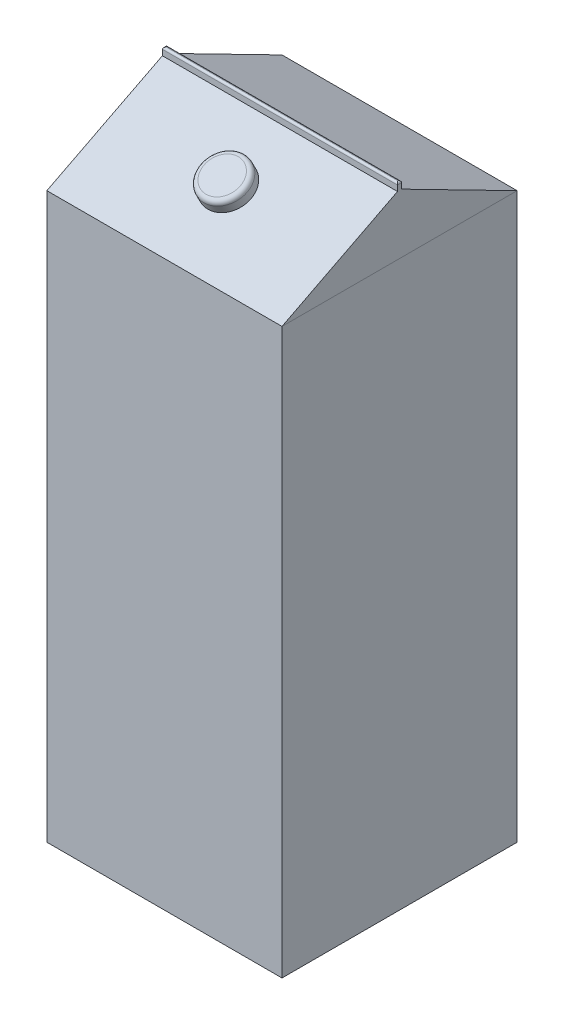
from build123d import *

# Parameters (mm, degrees)
SKETCH3_W           = 63.5
SKETCH3_H           = 152.4
BOSS_EXTRUDE3_DEPTH = 63.5
BOSS_EXTRUDE5_DEPTH = 63.5
FILLET5_R           = 0.508
SKETCH6_R           = 6.164809323
BOSS_EXTRUDE6_DEPTH = 3.556
FILLET6_R           = 1.27


with BuildPart() as part:
    # Sketch3 → Boss-Extrude3 (new body)
    with BuildSketch(Plane(origin=(0, 0, 0), x_dir=(0, 0, -1), z_dir=(1, 0, 0))):
        with Locations((31.75, 76.2)):
            Rectangle(SKETCH3_W, SKETCH3_H)
    extrude(amount=BOSS_EXTRUDE3_DEPTH)


with BuildPart() as body_2:
    # Sketch5 → Boss-Extrude5 (new body)
    with BuildSketch(Plane.ZY):
        Polygon((-31.75, 168.640265914), (0, 152.4), (-63.5, 152.4), align=None)
        Polygon((-32.306234982, 170.380405738), (-32.306234982, 168.355749252), (-31.75, 168.640265914), (-31.194792849, 168.356274992), (-31.194792849, 170.380405738), align=None)
    extrude(amount=-BOSS_EXTRUDE5_DEPTH)

    # Fillet5
    fillet5_edges = [body_2.edges().sort_by_distance(p)[0] for p in [
        (31.75, 170.380405738, -32.306234982),
        (31.75, 170.380405738, -31.194792849),
        (63.5, 170.380405738, -31.750513916),
        (0, 170.380405738, -31.750513916),
    ]]
    fillet(fillet5_edges, radius=FILLET5_R)

    # Sketch6 → Boss-Extrude6 (add)
    with BuildSketch(Plane(origin=(0, 120.795462819, 61.787415352), x_dir=(1, 0, 0), z_dir=(0, 0.8902927311327395, 0.4553886833159204))):
        with Locations(Location((31.975845376, 88.484921492, 0), (0, 0, 90))):
            Circle(SKETCH6_R)
    extrude(amount=BOSS_EXTRUDE6_DEPTH)

    # Fillet6
    fillet6_edges = [body_2.edges().sort_by_distance(p)[0] for p in [
        (31.975845376, 161.448991262, -9.882219979),
    ]]
    fillet(fillet6_edges, radius=FILLET6_R)


solid = Compound([part.part, body_2.part])
